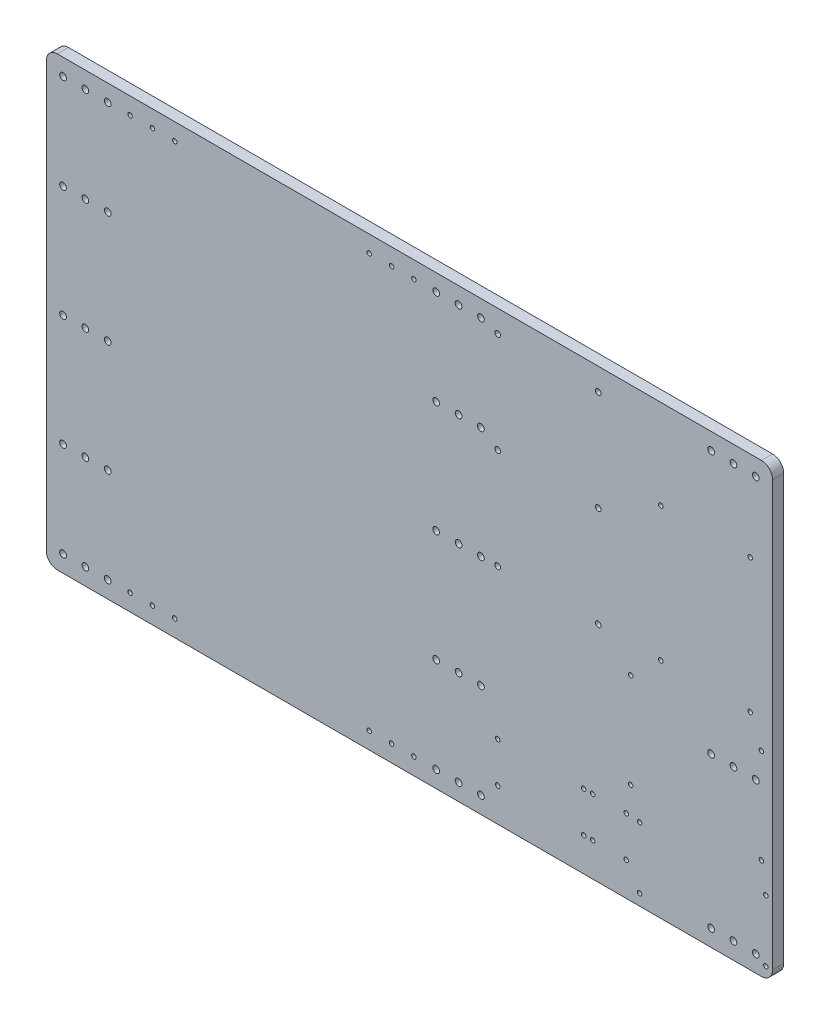
from build123d import *

# Parameters (mm, degrees)
SKETCH_1_W      = 650
SKETCH_1_H      = 400
SKETCH_1_R      = 3
SKETCH_1_R_2    = 2.5
SKETCH_1_R_3    = 2
EXTRUDE_1_DEPTH = 10
FILLET_1_R      = 10


with BuildPart() as part:
    # 草图1 → 凸台-拉伸1 (new body)
    with BuildSketch(Plane.XY):
        Rectangle(SKETCH_1_W, SKETCH_1_H)
        with Locations((-310, 100)):
            Circle(SKETCH_1_R, mode=Mode.SUBTRACT)
        with Locations((-290, 100)):
            Circle(SKETCH_1_R, mode=Mode.SUBTRACT)
        with Locations((-270, 100)):
            Circle(SKETCH_1_R, mode=Mode.SUBTRACT)
        with Locations((-310, 0)):
            Circle(SKETCH_1_R, mode=Mode.SUBTRACT)
        with Locations((-290, 0)):
            Circle(SKETCH_1_R, mode=Mode.SUBTRACT)
        with Locations((-270, 0)):
            Circle(SKETCH_1_R, mode=Mode.SUBTRACT)
        with Locations((-310, -100)):
            Circle(SKETCH_1_R, mode=Mode.SUBTRACT)
        with Locations((-290, -100)):
            Circle(SKETCH_1_R, mode=Mode.SUBTRACT)
        with Locations((-270, -100)):
            Circle(SKETCH_1_R, mode=Mode.SUBTRACT)
        with Locations((24, 100)):
            Circle(SKETCH_1_R, mode=Mode.SUBTRACT)
        with Locations((44, 100)):
            Circle(SKETCH_1_R, mode=Mode.SUBTRACT)
        with Locations((64, 100)):
            Circle(SKETCH_1_R, mode=Mode.SUBTRACT)
        with Locations((24, -100)):
            Circle(SKETCH_1_R, mode=Mode.SUBTRACT)
        with Locations((44, -100)):
            Circle(SKETCH_1_R, mode=Mode.SUBTRACT)
        with Locations((64, -100)):
            Circle(SKETCH_1_R, mode=Mode.SUBTRACT)
        with Locations((24, 0)):
            Circle(SKETCH_1_R, mode=Mode.SUBTRACT)
        with Locations((44, 0)):
            Circle(SKETCH_1_R, mode=Mode.SUBTRACT)
        with Locations((64, 0)):
            Circle(SKETCH_1_R, mode=Mode.SUBTRACT)
        with Locations((79, 180)):
            Circle(SKETCH_1_R_2, mode=Mode.SUBTRACT)
        with Locations((169, 180)):
            Circle(SKETCH_1_R_2, mode=Mode.SUBTRACT)
        with Locations((79, 90)):
            Circle(SKETCH_1_R_2, mode=Mode.SUBTRACT)
        with Locations((79, 0)):
            Circle(SKETCH_1_R_2, mode=Mode.SUBTRACT)
        with Locations((169, 90)):
            Circle(SKETCH_1_R_2, mode=Mode.SUBTRACT)
        with Locations((169, 0)):
            Circle(SKETCH_1_R_2, mode=Mode.SUBTRACT)
        with Locations((305, 120)):
            Circle(SKETCH_1_R_3, mode=Mode.SUBTRACT)
        with Locations((225, 120)):
            Circle(SKETCH_1_R_3, mode=Mode.SUBTRACT)
        with Locations((305, 0)):
            Circle(SKETCH_1_R_3, mode=Mode.SUBTRACT)
        with Locations((225, 0)):
            Circle(SKETCH_1_R_3, mode=Mode.SUBTRACT)
        with Locations((79, -134)):
            Circle(SKETCH_1_R_3, mode=Mode.SUBTRACT)
        with Locations((79, -170)):
            Circle(SKETCH_1_R_3, mode=Mode.SUBTRACT)
        with Locations((156, -134)):
            Circle(SKETCH_1_R_3, mode=Mode.SUBTRACT)
        with Locations((156, -170)):
            Circle(SKETCH_1_R_3, mode=Mode.SUBTRACT)
        with Locations((164, -134)):
            Circle(SKETCH_1_R_3, mode=Mode.SUBTRACT)
        with Locations((164, -170)):
            Circle(SKETCH_1_R_3, mode=Mode.SUBTRACT)
        with Locations((194, -134)):
            Circle(SKETCH_1_R_3, mode=Mode.SUBTRACT)
        with Locations((194, -170)):
            Circle(SKETCH_1_R_3, mode=Mode.SUBTRACT)
        with Locations((198, -25)):
            Circle(SKETCH_1_R_3, mode=Mode.SUBTRACT)
        with Locations((315, -25)):
            Circle(SKETCH_1_R_3, mode=Mode.SUBTRACT)
        with Locations((198, -110)):
            Circle(SKETCH_1_R_3, mode=Mode.SUBTRACT)
        with Locations((315, -110)):
            Circle(SKETCH_1_R_3, mode=Mode.SUBTRACT)
        with Locations((206, -190)):
            Circle(SKETCH_1_R_3, mode=Mode.SUBTRACT)
        with Locations((206, -135)):
            Circle(SKETCH_1_R_3, mode=Mode.SUBTRACT)
        with Locations((319, -190)):
            Circle(SKETCH_1_R_3, mode=Mode.SUBTRACT)
        with Locations((319, -135)):
            Circle(SKETCH_1_R_3, mode=Mode.SUBTRACT)
        with Locations((-310, -185)):
            Circle(SKETCH_1_R, mode=Mode.SUBTRACT)
        with Locations((-290, -185)):
            Circle(SKETCH_1_R, mode=Mode.SUBTRACT)
        with Locations((-270, -185)):
            Circle(SKETCH_1_R, mode=Mode.SUBTRACT)
        with Locations((24, -185)):
            Circle(SKETCH_1_R, mode=Mode.SUBTRACT)
        with Locations((44, -185)):
            Circle(SKETCH_1_R, mode=Mode.SUBTRACT)
        with Locations((64, -185)):
            Circle(SKETCH_1_R, mode=Mode.SUBTRACT)
        with Locations((-310, 185)):
            Circle(SKETCH_1_R, mode=Mode.SUBTRACT)
        with Locations((-290, 185)):
            Circle(SKETCH_1_R, mode=Mode.SUBTRACT)
        with Locations((-270, 185)):
            Circle(SKETCH_1_R, mode=Mode.SUBTRACT)
        with Locations((24, 185)):
            Circle(SKETCH_1_R, mode=Mode.SUBTRACT)
        with Locations((44, 185)):
            Circle(SKETCH_1_R, mode=Mode.SUBTRACT)
        with Locations((64, 185)):
            Circle(SKETCH_1_R, mode=Mode.SUBTRACT)
        with Locations((-36, 185)):
            Circle(SKETCH_1_R_3, mode=Mode.SUBTRACT)
        with Locations((-16, 185)):
            Circle(SKETCH_1_R_3, mode=Mode.SUBTRACT)
        with Locations((4, 185)):
            Circle(SKETCH_1_R_3, mode=Mode.SUBTRACT)
        with Locations((-250, 185)):
            Circle(SKETCH_1_R_3, mode=Mode.SUBTRACT)
        with Locations((-230, 185)):
            Circle(SKETCH_1_R_3, mode=Mode.SUBTRACT)
        with Locations((-210, 185)):
            Circle(SKETCH_1_R_3, mode=Mode.SUBTRACT)
        with Locations((-250, -185)):
            Circle(SKETCH_1_R_3, mode=Mode.SUBTRACT)
        with Locations((-230, -185)):
            Circle(SKETCH_1_R_3, mode=Mode.SUBTRACT)
        with Locations((-210, -185)):
            Circle(SKETCH_1_R_3, mode=Mode.SUBTRACT)
        with Locations((4, -185)):
            Circle(SKETCH_1_R_3, mode=Mode.SUBTRACT)
        with Locations((-16, -185)):
            Circle(SKETCH_1_R_3, mode=Mode.SUBTRACT)
        with Locations((-36, -185)):
            Circle(SKETCH_1_R_3, mode=Mode.SUBTRACT)
        with Locations((310, -185)):
            Circle(SKETCH_1_R, mode=Mode.SUBTRACT)
        with Locations((290, -185)):
            Circle(SKETCH_1_R, mode=Mode.SUBTRACT)
        with Locations((270, -185)):
            Circle(SKETCH_1_R, mode=Mode.SUBTRACT)
        with Locations((310, 185)):
            Circle(SKETCH_1_R, mode=Mode.SUBTRACT)
        with Locations((270, 185)):
            Circle(SKETCH_1_R, mode=Mode.SUBTRACT)
        with Locations((290, 185)):
            Circle(SKETCH_1_R, mode=Mode.SUBTRACT)
        with Locations((270, -50)):
            Circle(SKETCH_1_R, mode=Mode.SUBTRACT)
        with Locations((290, -50)):
            Circle(SKETCH_1_R, mode=Mode.SUBTRACT)
        with Locations((310, -50)):
            Circle(SKETCH_1_R, mode=Mode.SUBTRACT)
    extrude(amount=EXTRUDE_1_DEPTH)

    # 圆角1
    fillet_1_edges = [part.edges().sort_by_distance(p)[0] for p in [
        (325, -200, 5),
        (-325, -200, 5),
        (-325, 200, 5),
        (325, 200, 5),
    ]]
    fillet(fillet_1_edges, radius=FILLET_1_R)


solid = part.part
